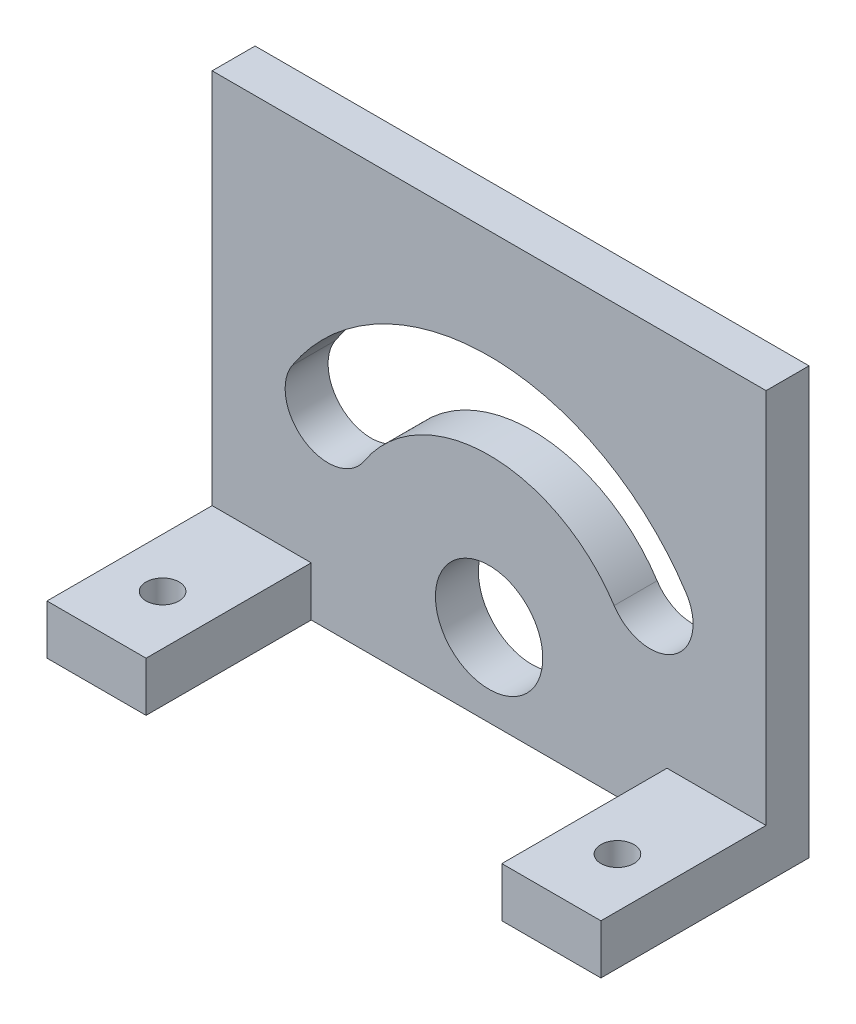
from build123d import *

# Parameters (mm, degrees)
BOSS_EXTRU_1_DEPTH      = 1
ESQUISSE3_R             = 1.25
ENL_V_MAT_EXTRU_1_DEPTH = 3.45
ENL_V_MAT_EXTRU_2_DEPTH = 3.45
SCALE1_SCALE            = 6.5
CUT_EXTRUDE1_DEPTH      = 86.932976581
CUT_EXTRUDE1_DEPTH_BACK = 86.932976581
SKETCH2_W               = 15
SKETCH2_H               = 25
BOSS_EXTRUDE1_DEPTH     = 7.5
SKETCH3_R               = 2.5
CUT_EXTRUDE3_DEPTH      = 93.395152617


with BuildPart() as part:
    # Esquisse1 → Boss.-Extru.1 (new body)
    with BuildSketch(Plane.XY):
        Polygon((15.875, -11.8), (17.7, -11.8), (17.7, 0), (13.225, 0), (9.275, 0), (0, 0), (0, -11.8), (6.625, -11.8), (6.625, -13.9), (15.875, -13.9), align=None)
    extrude(amount=BOSS_EXTRU_1_DEPTH)

    # Esquisse3 → Enlèv. mat.-Extru.1 (cut)
    with BuildSketch(Plane(origin=(0, 0, 0), x_dir=(-1, 0, 0), z_dir=(0, 0, -1))):
        with Locations((-11.25, -8)):
            Circle(ESQUISSE3_R)
    extrude(amount=-ENL_V_MAT_EXTRU_1_DEPTH, mode=Mode.SUBTRACT)

    # Esquisse5 → Enlèv. mat.-Extru.2 (cut)
    with BuildSketch(Plane(origin=(0, 0, 0), x_dir=(-1, 0, 0), z_dir=(0, 0, -1))):
        with BuildLine():
            ThreePointArc((-6.662011173, -5.012361547), (-11.25, -2.525), (-15.837988827, -5.012361547))
            ThreePointArc((-15.837988827, -5.012361547), (-15.545687389, -6.396037763), (-14.162011173, -6.103736324))
            ThreePointArc((-14.162011173, -6.103736324), (-11.25, -4.525), (-8.337988827, -6.103736324))
            ThreePointArc((-8.337988827, -6.103736324), (-6.954312611, -6.396037763), (-6.662011173, -5.012361547))
        make_face()
    extrude(amount=-ENL_V_MAT_EXTRU_2_DEPTH, mode=Mode.SUBTRACT)


with BuildPart() as part_1:
    # Scale1: scaled about (8.774004249, -6.668318819, 0.5)
    add(part.part.scale(SCALE1_SCALE).moved(Location((-48.25702337, 36.675753504, -2.75))))

    # Sketch1 → Cut-Extrude1 (cut, two sides: drawn at the far end of the back side and taken through both)
    with BuildSketch(Plane(origin=(0, 0, -2.75), x_dir=(-1, 0, 0), z_dir=(0, 0, -1)).offset(-CUT_EXTRUDE1_DEPTH_BACK)):
        Polygon((-66.79297663, -27.824246495), (17.05702337, -27.824246495), (17.05702337, 36.675753505), (48.25702337, 36.675753505), (48.25702337, -27.824246495), (48.25702337, -58.098552113), (-66.79297663, -58.098552113), align=None)
    extrude(amount=CUT_EXTRUDE1_DEPTH + CUT_EXTRUDE1_DEPTH_BACK, mode=Mode.SUBTRACT)

    # Sketch2 → Boss-Extrude1 (add)
    with BuildSketch(Plane.XZ.offset(27.824246495)):
        with Locations((-9.55702337, 16.25)):
            Rectangle(SKETCH2_W, SKETCH2_H)
        with Locations((59.29297663, 16.25)):
            Rectangle(SKETCH2_W, SKETCH2_H)
    extrude(amount=-BOSS_EXTRUDE1_DEPTH)

    # Sketch3 → Cut-Extrude3 (cut, through all)
    with BuildSketch(Plane(origin=(0, -20.324246495, 0), x_dir=(1, 0, 0), z_dir=(0, 1, 0))):
        with Locations(Location((-9.55702337, -18.75, 0), (0, 0, 270))):
            Circle(SKETCH3_R)
        with Locations(Location((59.29297663, -18.75, 0), (0, 0, 90))):
            Circle(SKETCH3_R)
    extrude(amount=-CUT_EXTRUDE3_DEPTH, mode=Mode.SUBTRACT)


solid = part_1.part
